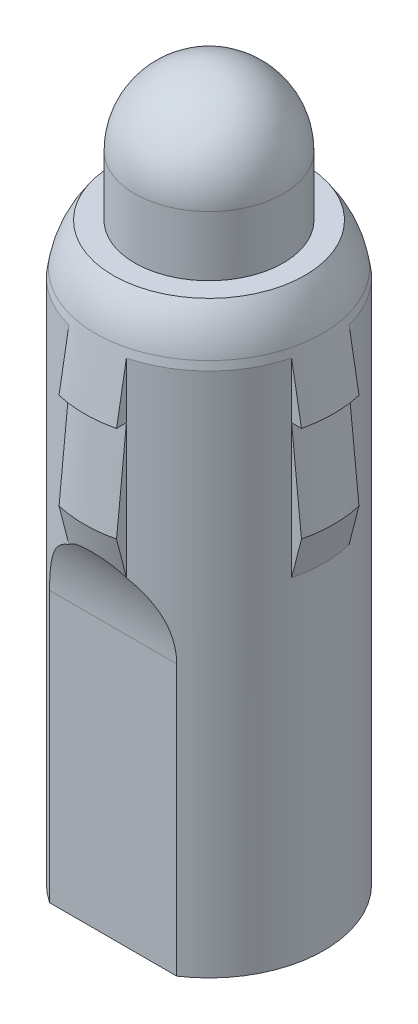
from build123d import *

# Parameters (mm, degrees)
CUT_EXTRUDE1_DEPTH = 39.124795081
CUT_EXTRUDE2_DEPTH = 10


with BuildPart() as part:
    # Sketch2 → Revolve1 (revolve)
    with BuildSketch(Plane.XY, mode=Mode.PRIVATE) as revolve1_sk:
        with BuildLine():
            Line((0, 0), (6, 0))
            Line((6, 0), (6, 17.5))
            Line((6, 17.5), (6.5, 19.5))
            Line((6.5, 19.5), (6, 24.5))
            Line((6, 24.5), (6.5, 24.5))
            Line((6.5, 24.5), (5.928481161, 27.842658555))
            ThreePointArc((5.928481161, 27.842658555), (5.59270884, 28.976619718), (5, 30))
            Line((5, 30), (3.875, 30))
            Line((3.875, 30), (3.875, 33.125))
            ThreePointArc((3.875, 33.125), (2.740038777, 35.865038777), (0, 37))
            Line((0, 37), (0, 0))
        make_face()
    revolve(revolve1_sk.sketch.rotate(Axis((0, 37, 0), (0, -1, 0)), 90), axis=Axis((0, 37, 0), (0, -1, 0)))

    # Sketch3 → Cut-Extrude1 (cut, through all)
    with BuildSketch(Plane.XZ):
        with BuildLine():
            Line((-5.809475019, 1.5), (-7.579692196, 1.5))
            Line((-7.579692196, 1.5), (-7.579692196, 7.495465701))
            Line((-7.579692196, 7.495465701), (-1.5, 7.495465701))
            Line((-1.5, 7.495465701), (-1.5, 5.809475019))
            ThreePointArc((-1.5, 5.809475019), (-4.242640687, 4.242640687), (-5.809475019, 1.5))
        make_face()
        with BuildLine():
            Line((1.5, 7.495465701), (1.5, 5.809475019))
            ThreePointArc((1.5, 5.809475019), (4.242640687, 4.242640687), (5.809475019, 1.5))
            Line((5.809475019, 1.5), (7.579692196, 1.5))
            Line((7.579692196, 1.5), (7.579692196, 7.495465701))
            Line((7.579692196, 7.495465701), (1.5, 7.495465701))
        make_face()
        with BuildLine():
            Line((5.809475019, -1.5), (7.579692196, -1.5))
            Line((7.579692196, -1.5), (7.579692196, -7.495465701))
            Line((7.579692196, -7.495465701), (1.5, -7.495465701))
            Line((1.5, -7.495465701), (1.5, -5.809475019))
            ThreePointArc((1.5, -5.809475019), (4.242640687, -4.242640687), (5.809475019, -1.5))
        make_face()
        with BuildLine():
            Line((-1.5, -7.495465701), (-1.5, -5.809475019))
            ThreePointArc((-1.5, -5.809475019), (-4.242640687, -4.242640687), (-5.809475019, -1.5))
            Line((-5.809475019, -1.5), (-7.579692196, -1.5))
            Line((-7.579692196, -1.5), (-7.579692196, -7.495465701))
            Line((-7.579692196, -7.495465701), (-1.5, -7.495465701))
        make_face()
    extrude(amount=-CUT_EXTRUDE1_DEPTH, mode=Mode.SUBTRACT)

    # Sketch4 → Cut-Extrude2 (cut, symmetric)
    with BuildSketch(Plane(origin=(0, 0, 0), x_dir=(0, 0, -1), z_dir=(1, 0, 0))):
        with BuildLine():
            Line((-5, 0), (-5, 14.110770665))
            ThreePointArc((-5, 14.110770665), (-7.196699141, 19.414071524), (-12.5, 21.610770665))
            Line((-12.5, 21.610770665), (-12.5, 0))
            Line((-12.5, 0), (-5, 0))
        make_face()
        with BuildLine():
            Line((12.5, 0), (5, 0))
            Line((5, 0), (5, 14.110770665))
            ThreePointArc((5, 14.110770665), (7.196699141, 19.414071524), (12.5, 21.610770665))
            Line((12.5, 21.610770665), (12.5, 0))
        make_face()
    extrude(amount=CUT_EXTRUDE2_DEPTH, both=True, mode=Mode.SUBTRACT)


solid = part.part
